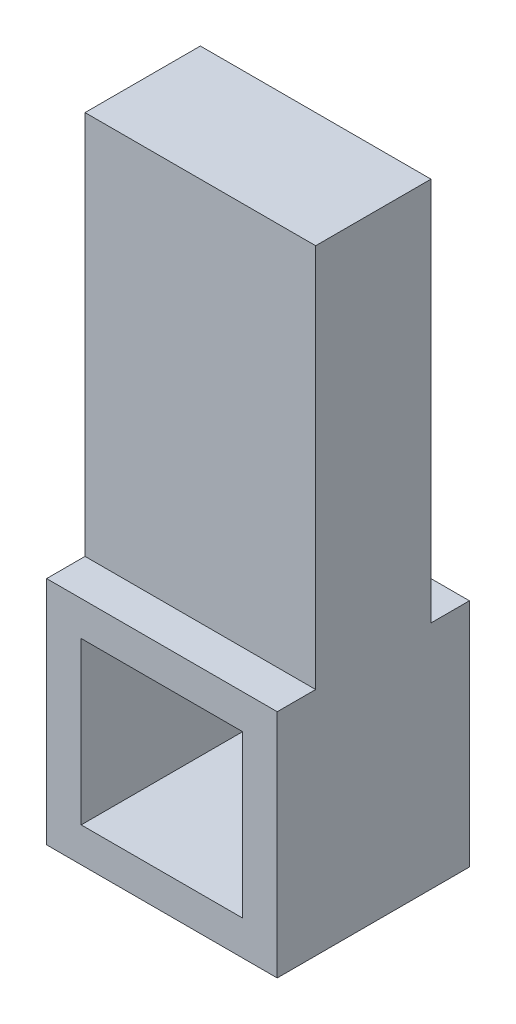
from build123d import *

# Parameters (mm, degrees)
SKETCH1_W           = 6
SKETCH1_H           = 6
SKETCH1_W_2         = 4.2
SKETCH1_H_2         = 4.2
BOSS_EXTRUDE1_DEPTH = 2.5
SKETCH2_W           = 6
SKETCH2_H           = 10
BOSS_EXTRUDE2_DEPTH = 1.5


with BuildPart() as part:
    # Sketch1 → Boss-Extrude1 (new, symmetric)
    with BuildSketch(Plane.XY):
        Rectangle(SKETCH1_W, SKETCH1_H)
        Rectangle(SKETCH1_W_2, SKETCH1_H_2, mode=Mode.SUBTRACT)
    extrude(amount=BOSS_EXTRUDE1_DEPTH, both=True)

    # Sketch2 → Boss-Extrude2 (add, symmetric)
    with BuildSketch(Plane.XY):
        with Locations((0, 8)):
            Rectangle(SKETCH2_W, SKETCH2_H)
    extrude(amount=BOSS_EXTRUDE2_DEPTH, both=True)


solid = part.part
